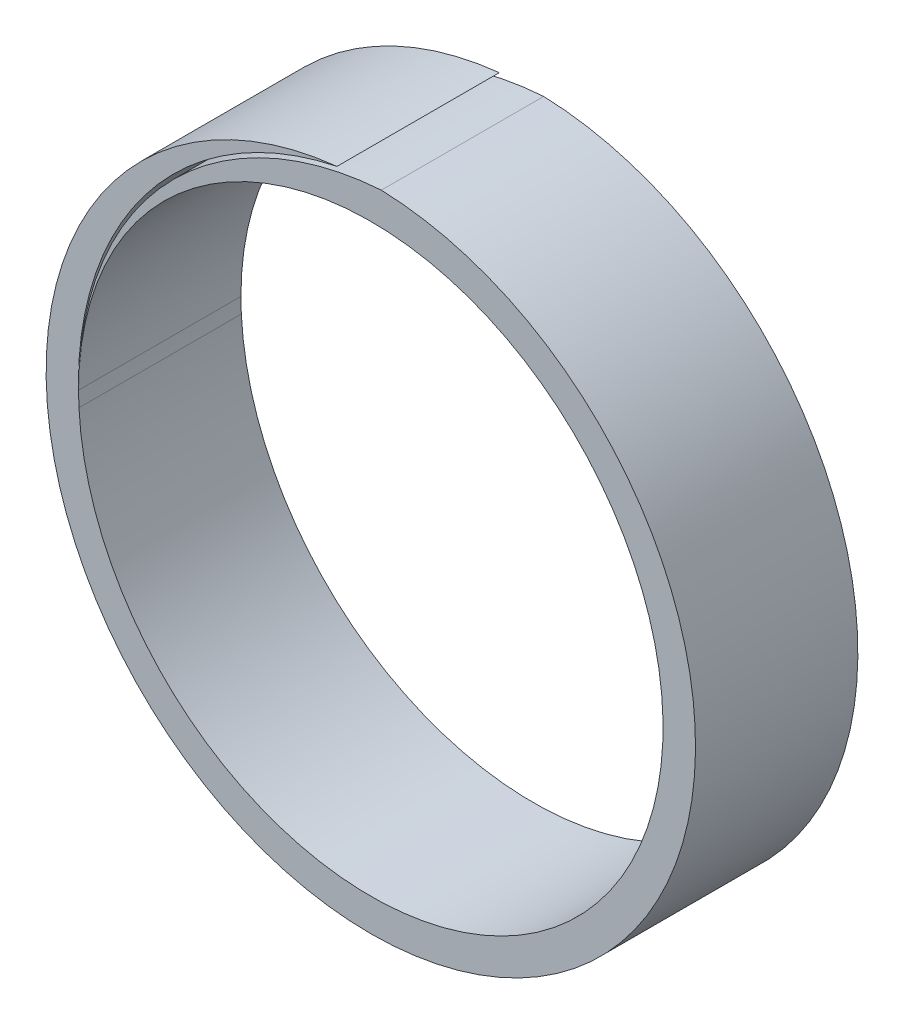
from build123d import *

# Parameters (mm, degrees)
BOSS_EXTRUDE1_DEPTH = 10


with BuildPart() as part:
    # Sketch1 → Boss-Extrude1 (new body)
    with BuildSketch(Plane.XY):
        with BuildLine():
            ThreePointArc((-2.085662385, 19.890953029), (0.720985818, -19.987000261), (0.647064182, 19.989529958))
            ThreePointArc((0.647064182, 19.989529958), (-12.624723607, 13.677861958), (-18, 0))
            ThreePointArc((-18, 0), (17.993996144, 0.464868564), (-17.97598858, -0.929427016))
            ThreePointArc((-17.97598858, -0.929427016), (-13.913036193, 12.443705778), (-2.085662385, 19.890953029))
        make_face()
    extrude(amount=BOSS_EXTRUDE1_DEPTH)


solid = part.part
